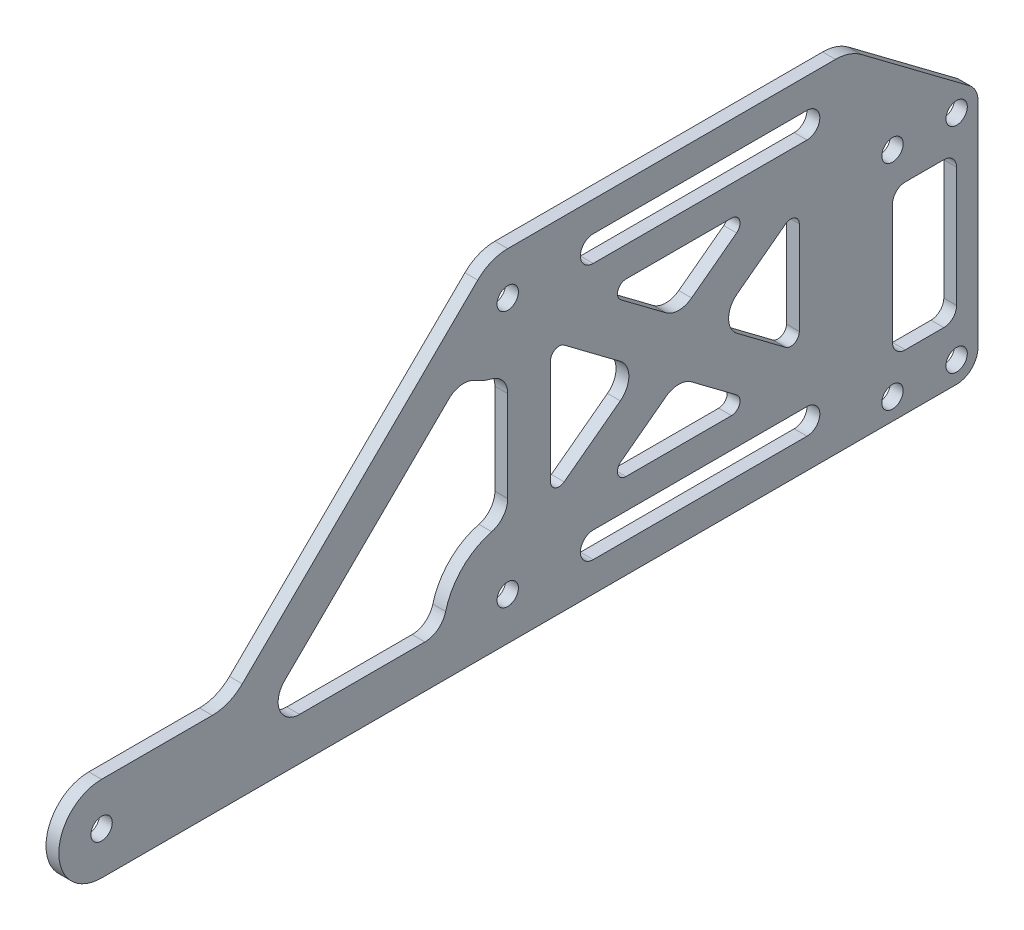
from build123d import *

# Parameters (mm, degrees)
SKETCH_1_R      = 2.5
EXTRUDE_1_DEPTH = 3


with BuildPart() as part:
    # 草图1 → 凸台-拉伸1 (new body)
    with BuildSketch(Plane(origin=(0, 0, 0), x_dir=(0, 0, -1), z_dir=(1, 0, 0))):
        with BuildLine():
            Line((0, -10), (175, -10))
            Line((175, -10), (200, -10))
            ThreePointArc((200, -10), (203.535533906, -8.535533906), (205, -5))
            Line((205, -5), (205, 45))
            ThreePointArc((205, 45), (204.472135955, 47.236067977), (203, 49))
            Line((203, 49), (177.666666667, 68))
            ThreePointArc((177.666666667, 68), (174.828944327, 69.486832981), (171.666666667, 70))
            Line((171.666666667, 70), (95, 70))
            ThreePointArc((95, 70), (91.207635036, 69.252997784), (87.98185108, 67.123593597))
            Line((87.98185108, 67.123593597), (32.919623175, 12.876406403))
            ThreePointArc((32.919623175, 12.876406403), (29.693839218, 10.747002216), (25.901474255, 10))
            Line((25.901474255, 10), (0, 10))
            ThreePointArc((0, 10), (-10, 0), (0, -10))
        make_face()
        Circle(SKETCH_1_R, mode=Mode.SUBTRACT)
        with Locations((95, 0)):
            Circle(SKETCH_1_R, mode=Mode.SUBTRACT)
        with Locations((95, 60)):
            Circle(SKETCH_1_R, mode=Mode.SUBTRACT)
        with Locations((200, 45)):
            Circle(SKETCH_1_R, mode=Mode.SUBTRACT)
        with Locations((200, -5)):
            Circle(SKETCH_1_R, mode=Mode.SUBTRACT)
        with Locations((185, 45)):
            Circle(SKETCH_1_R, mode=Mode.SUBTRACT)
        with Locations((185, -5)):
            Circle(SKETCH_1_R, mode=Mode.SUBTRACT)
        with BuildLine():
            Line((46.298034327, 0), (75.635083269, 0))
            ThreePointArc((75.635083269, 0), (78.696945447, 1.047152925), (80.476312452, 3.75))
            ThreePointArc((80.476312452, 3.75), (84.393398282, 10.606601718), (91.25, 14.523687548))
            ThreePointArc((91.25, 14.523687548), (93.952847075, 16.303054553), (95, 19.364916731))
            Line((95, 19.364916731), (95, 40.635083269))
            ThreePointArc((95, 40.635083269), (93.952847075, 43.696945447), (91.25, 45.476312452))
            ThreePointArc((91.25, 45.476312452), (89.208124255, 46.163303308), (87.285721083, 47.135712192))
            ThreePointArc((87.285721083, 47.135712192), (84.121274015, 47.812324342), (81.205220318, 46.409413055))
            Line((81.205220318, 46.409413055), (42.788959867, 8.561796798))
            ThreePointArc((42.788959867, 8.561796798), (41.671535435, 3.103817518), (46.298034327, 0))
        make_face(mode=Mode.SUBTRACT)
        with BuildLine():
            Line((108.2, 43.85), (121.333333333, 34))
            ThreePointArc((121.333333333, 34), (123.333333333, 30), (121.333333333, 26))
            Line((121.333333333, 26), (108.2, 16.15))
            ThreePointArc((108.2, 16.15), (106.105572809, 15.961145618), (105, 17.75))
            Line((105, 17.75), (105, 42.25))
            ThreePointArc((105, 42.25), (106.105572809, 44.038854382), (108.2, 43.85))
        make_face(mode=Mode.SUBTRACT)
        with BuildLine():
            Line((122.666666667, 50), (147.333333333, 50))
            ThreePointArc((147.333333333, 50), (149.230699929, 48.632455532), (148.533333333, 46.4))
            Line((148.533333333, 46.4), (138, 38.5))
            ThreePointArc((138, 38.5), (135, 37.5), (132, 38.5))
            Line((132, 38.5), (121.466666667, 46.4))
            ThreePointArc((121.466666667, 46.4), (120.769300071, 48.632455532), (122.666666667, 50))
        make_face(mode=Mode.SUBTRACT)
        with BuildLine():
            Line((163.201700099, 40.901275074), (163.201700099, 19.098724926))
            ThreePointArc((163.201700099, 19.098724926), (162.09612729, 17.309870544), (160.001700099, 17.498724926))
            Line((160.001700099, 17.498724926), (148.666666667, 26))
            ThreePointArc((148.666666667, 26), (146.666666667, 30), (148.666666667, 34))
            Line((148.666666667, 34), (160.001700099, 42.501275074))
            ThreePointArc((160.001700099, 42.501275074), (162.09612729, 42.690129456), (163.201700099, 40.901275074))
        make_face(mode=Mode.SUBTRACT)
        with BuildLine():
            Line((121.466666667, 13.6), (132, 21.5))
            ThreePointArc((132, 21.5), (135, 22.5), (138, 21.5))
            Line((138, 21.5), (148.533333333, 13.6))
            ThreePointArc((148.533333333, 13.6), (149.230699929, 11.367544468), (147.333333333, 10))
            Line((147.333333333, 10), (122.666666667, 10))
            ThreePointArc((122.666666667, 10), (120.769300071, 11.367544468), (121.466666667, 13.6))
        make_face(mode=Mode.SUBTRACT)
        with BuildLine():
            Line((115, 63), (165, 63))
            ThreePointArc((165, 63), (168, 60), (165, 57))
            Line((165, 57), (115, 57))
            ThreePointArc((115, 57), (112, 60), (115, 63))
        make_face(mode=Mode.SUBTRACT)
        with BuildLine():
            Line((115, 3), (165, 3))
            ThreePointArc((165, 3), (168, 0), (165, -3))
            Line((165, -3), (115, -3))
            ThreePointArc((115, -3), (112, 0), (115, 3))
        make_face(mode=Mode.SUBTRACT)
        with BuildLine():
            Line((188, 37), (197, 37))
            ThreePointArc((197, 37), (199.121320344, 36.121320344), (200, 34))
            Line((200, 34), (200, 6))
            ThreePointArc((200, 6), (199.121320344, 3.878679656), (197, 3))
            Line((197, 3), (188, 3))
            ThreePointArc((188, 3), (185.878679656, 3.878679656), (185, 6))
            Line((185, 6), (185, 34))
            ThreePointArc((185, 34), (185.878679656, 36.121320344), (188, 37))
        make_face(mode=Mode.SUBTRACT)
    extrude(amount=EXTRUDE_1_DEPTH)


solid = part.part
